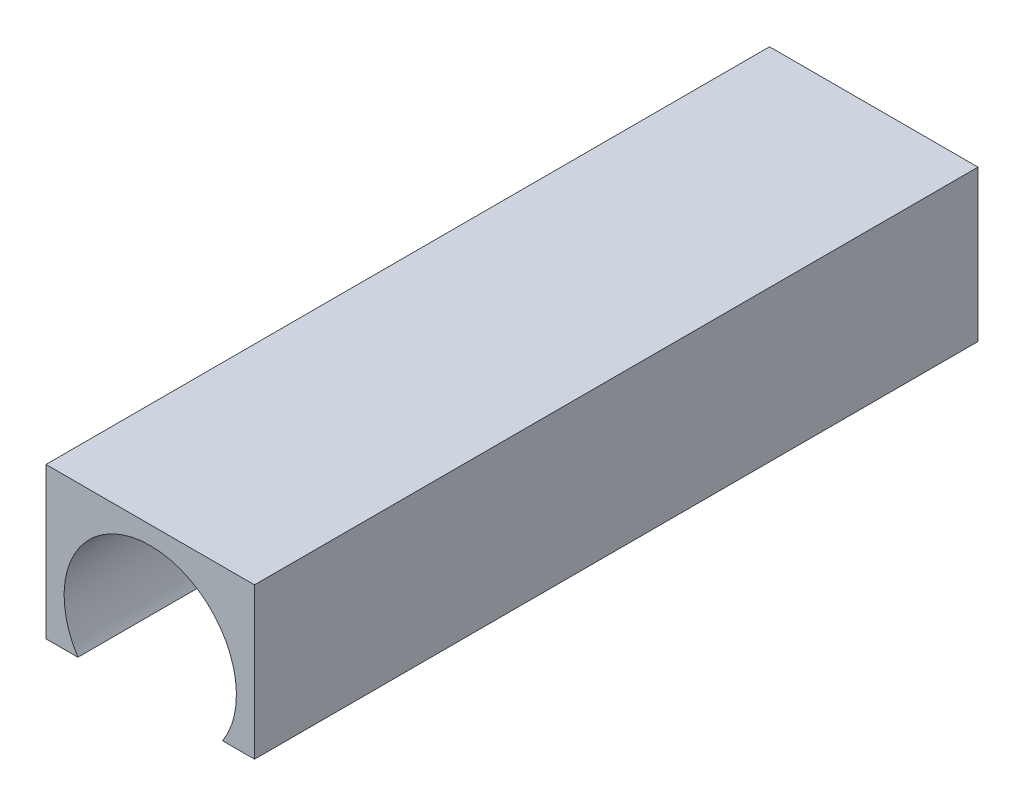
from build123d import *

# Parameters (mm, degrees)
BOSS_EXTRUDE1_DEPTH = 12.7


with BuildPart() as part:
    # Sketch1 → Boss-Extrude1 (new, symmetric)
    with BuildSketch(Plane.XY):
        with BuildLine():
            Line((0, 0), (1.12, 0))
            ThreePointArc((1.12, 0), (3.66, 4.667870963), (6.2, 0))
            Line((6.2, 0), (7.32, 0))
            Line((7.32, 0), (7.32, 5.302870963))
            Line((7.32, 5.302870963), (0, 5.302870963))
            Line((0, 5.302870963), (0, 0))
        make_face()
    extrude(amount=BOSS_EXTRUDE1_DEPTH, both=True)


solid = part.part
